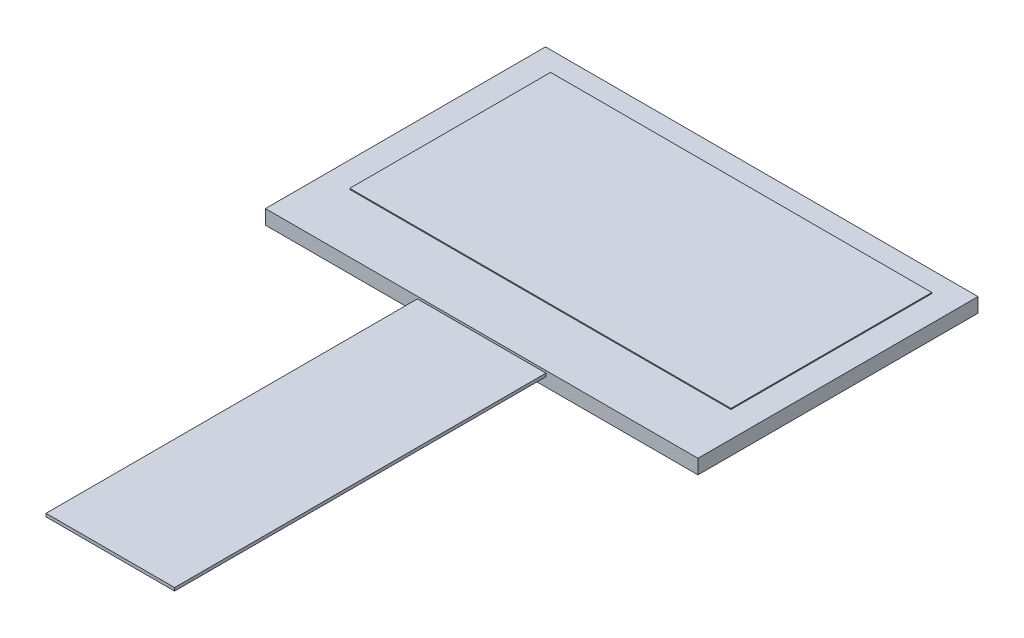
from build123d import *

# Parameters (mm, degrees)
SKETCH_1_W      = 42.04
SKETCH_1_H      = 27.22
EXTRUDE_1_DEPTH = 1.4
SKETCH_2_W      = 37.052
SKETCH_2_H      = 19.516
EXTRUDE_2_DEPTH = 0.1
SKETCH_3_W      = 12.5
SKETCH_3_H      = 0.3
EXTRUDE_3_DEPTH = 36.1


with BuildPart() as part:
    # 草图1 → 凸台-拉伸1 (new body)
    with BuildSketch(Plane(origin=(0, 0, 0), x_dir=(1, 0, 0), z_dir=(0, 1, 0))):
        Rectangle(SKETCH_1_W, SKETCH_1_H)
    extrude(amount=EXTRUDE_1_DEPTH)

    # 草图2 → 凸台-拉伸2 (add)
    with BuildSketch(Plane(origin=(0, 1.4, 0), x_dir=(1, 0, 0), z_dir=(0, 1, 0))):
        with Locations((0, 1.852)):
            Rectangle(SKETCH_2_W, SKETCH_2_H)
    extrude(amount=EXTRUDE_2_DEPTH)

    # 草图3 → 凸台-拉伸3 (add)
    with BuildSketch(Plane.XY.offset(13.61)):
        with Locations((0, 1.031860601)):
            Rectangle(SKETCH_3_W, SKETCH_3_H)
    extrude(amount=EXTRUDE_3_DEPTH)


solid = part.part
